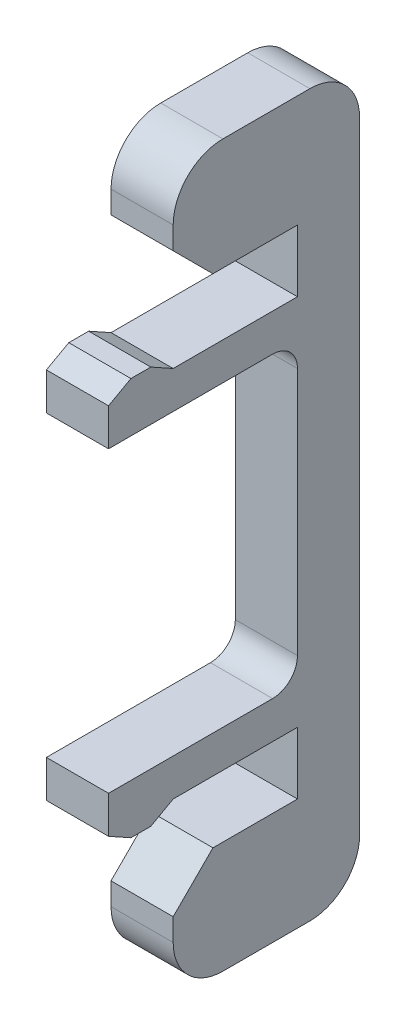
from build123d import *

# Parameters (mm, degrees)
SKETCH1_W      = 3.175
SKETCH1_H      = 36.83
BASE_DEPTH     = 3.175
SKETCH3_W      = 6.35
SKETCH3_H      = 5.715
RETAINER_DEPTH = 3.175
TAB_DEPTH      = 3.175
FILLET1_R      = 1.27
FILLET2_R      = 2.54
CHAMFER1_SIZE  = 2.032


with BuildPart() as part:
    # Sketch1 → Base (new body)
    with BuildSketch(Plane.XY):
        Rectangle(SKETCH1_W, SKETCH1_H)
    extrude(amount=BASE_DEPTH)

    # Sketch3 → Retainer (add)
    with BuildSketch(Plane.ZY.offset(1.5875)):
        with Locations((6.35, 15.5575)):
            Rectangle(SKETCH3_W, SKETCH3_H)
        with Locations((6.35, -15.5575)):
            Rectangle(SKETCH3_W, SKETCH3_H)
    extrude(amount=-RETAINER_DEPTH)

    # Sketch5 → Tab (add)
    with BuildSketch(Plane.ZY.offset(1.5875)):
        Polygon((3.175, 9.525), (9.525, 9.525), (10.668, 10.16), (11.684, 10.16), (12.827, 9.525), (12.827, 7.62), (3.175, 7.62), align=None)
        Polygon((12.827, -7.62), (3.175, -7.62), (3.175, -9.525), (9.525, -9.525), (10.668, -10.16), (11.684, -10.16), (12.827, -9.525), align=None)
    extrude(amount=-TAB_DEPTH)

    # Fillet1
    fillet1_edges = [part.edges().sort_by_distance(p)[0] for p in [
        (0, 7.62, 3.175),
        (0, -7.62, 3.175),
    ]]
    fillet(fillet1_edges, radius=FILLET1_R)

    # Fillet2
    fillet2_edges = [part.edges().sort_by_distance(p)[0] for p in [
        (0, 18.415, 9.525),
        (0, -18.415, 9.525),
        (0, -18.415, 0),
        (0, 18.415, 0),
    ]]
    fillet(fillet2_edges, radius=FILLET2_R)

    # Chamfer1
    chamfer1_edges = [part.edges().sort_by_distance(p)[0] for p in [
        (0, 12.7, 9.525),
        (0, -12.7, 9.525),
    ]]
    chamfer(chamfer1_edges, length=CHAMFER1_SIZE)


solid = part.part
